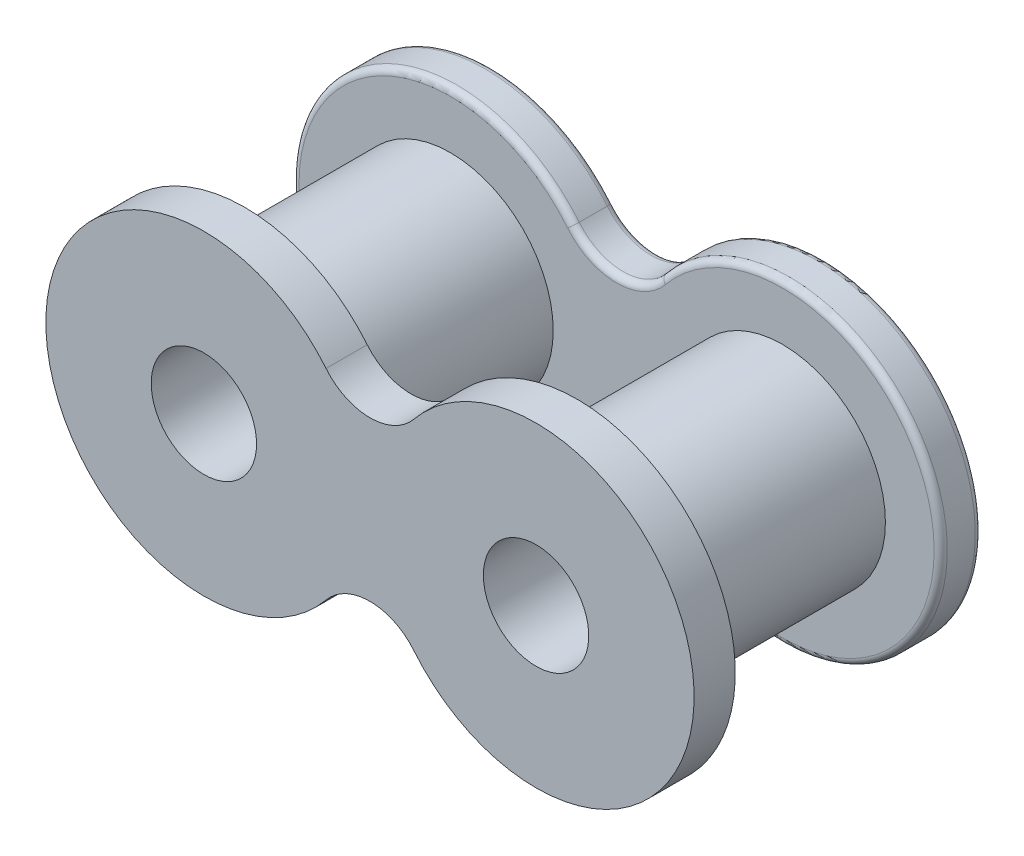
from build123d import *

# Parameters (mm, degrees)
SKETCH1_R           = 2.032
BOSS_EXTRUDE1_DEPTH = 1.5875
FILLET1_R           = 0.254
SKETCH2_R           = 3.9624
SKETCH2_R_2         = 2.032
BOSS_EXTRUDE2_DEPTH = 7.9248


with BuildPart() as part:
    # Sketch1 → Boss-Extrude1 (new body)
    with BuildSketch(Plane.XY):
        with BuildLine():
            ThreePointArc((-1.693907172, 3.866960894), (-12.502425548, 0), (-1.693907172, -3.866960894))
            ThreePointArc((-1.693907172, -3.866960894), (0, -3.065736362), (1.693907172, -3.866960894))
            ThreePointArc((1.693907172, -3.866960894), (12.502425548, 0), (1.693907172, 3.866960894))
            ThreePointArc((1.693907172, 3.866960894), (0, 3.065736362), (-1.693907172, 3.866960894))
        make_face()
        with Locations((-6.406425548, 0)):
            Circle(SKETCH1_R, mode=Mode.SUBTRACT)
        with Locations(Location((6.406425548, 0, 0), (0, 0, 180))):
            Circle(SKETCH1_R, mode=Mode.SUBTRACT)
    boss_extrude1 = extrude(amount=BOSS_EXTRUDE1_DEPTH)

    # Fillet1
    fillet1_edges = [part.edges().sort_by_distance(p)[0] for p in [
        (0, -3.065736362, 1.5875),
        (-8.438425548, 0, 0),
        (-8.438425548, 0, 1.5875),
        (12.502425548, 0, 1.5875),
        (8.438425548, 0, 0),
        (8.438425548, 0, 1.5875),
        (0, 3.065736362, 1.5875),
        (12.502425548, 0, 0),
        (0, -3.065736362, 0),
        (-12.502425548, 0, 0),
        (0, 3.065736362, 0),
        (-12.502425548, 0, 1.5875),
    ]]
    fillet(fillet1_edges, radius=FILLET1_R)

    # Sketch2 → Boss-Extrude2 (add)
    with BuildSketch(Plane.XY.offset(1.5875)):
        with Locations((-6.406425548, 0)):
            Circle(SKETCH2_R)
        with Locations((-6.406425548, 0)):
            Circle(SKETCH2_R_2, mode=Mode.SUBTRACT)
    boss_extrude2 = extrude(amount=BOSS_EXTRUDE2_DEPTH)

    # Mirror1: Boss-Extrude2 across plane
    add(boss_extrude2.mirror(Plane(origin=(0, 0, 0), x_dir=(0, 0, 1), z_dir=(1, 0, 0))))

    # Mirror2: Boss-Extrude1 across plane
    add(boss_extrude1.mirror(Plane.XY.offset(5.5499)))


solid = part.part
